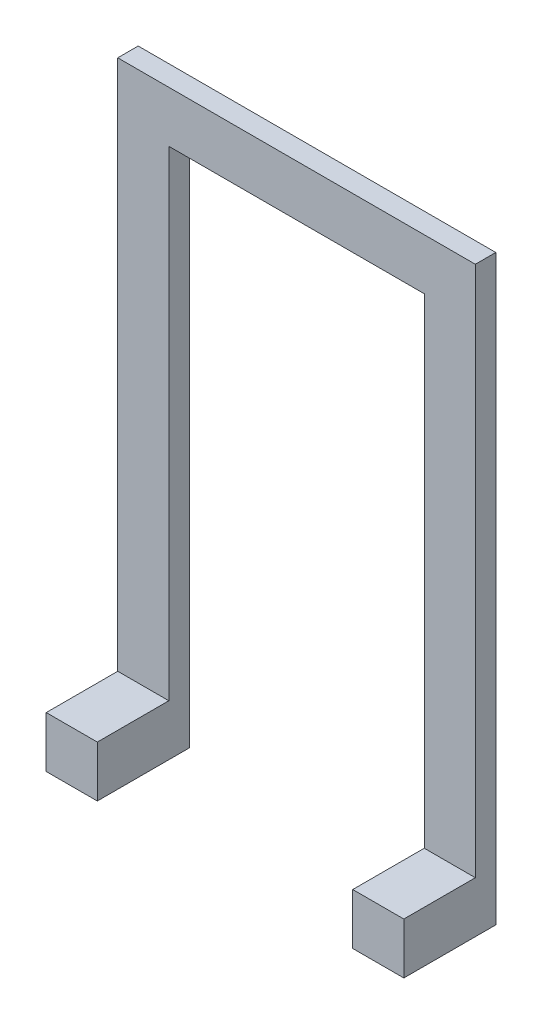
from build123d import *

# Parameters (mm, degrees)
SKETCH1_W           = 2.5
SKETCH1_H           = 26
BOSS_EXTRUDE1_DEPTH = 1
SKETCH2_W           = 2.5
SKETCH2_H           = 2.5
BOSS_EXTRUDE2_DEPTH = 3.5


with BuildPart() as part:
    # Sketch1 → Boss-Extrude1 (new body)
    with BuildSketch(Plane.XY):
        with Locations((-7.5, -4.25)):
            Rectangle(SKETCH1_W, SKETCH1_H)
        Polygon((-8.75, 11.25), (-8.75, 8.75), (-6.25, 8.75), (6.25, 8.75), (8.75, 8.75), (8.75, 11.25), align=None)
        with Locations((7.5, -4.25)):
            Rectangle(SKETCH1_W, SKETCH1_H)
    extrude(amount=BOSS_EXTRUDE1_DEPTH)

    # Sketch2 → Boss-Extrude2 (add)
    with BuildSketch(Plane.XY.offset(1)):
        with Locations((-7.5, -16)):
            Rectangle(SKETCH2_W, SKETCH2_H)
        with Locations((7.5, -16)):
            Rectangle(SKETCH2_W, SKETCH2_H)
    extrude(amount=BOSS_EXTRUDE2_DEPTH)


solid = part.part
